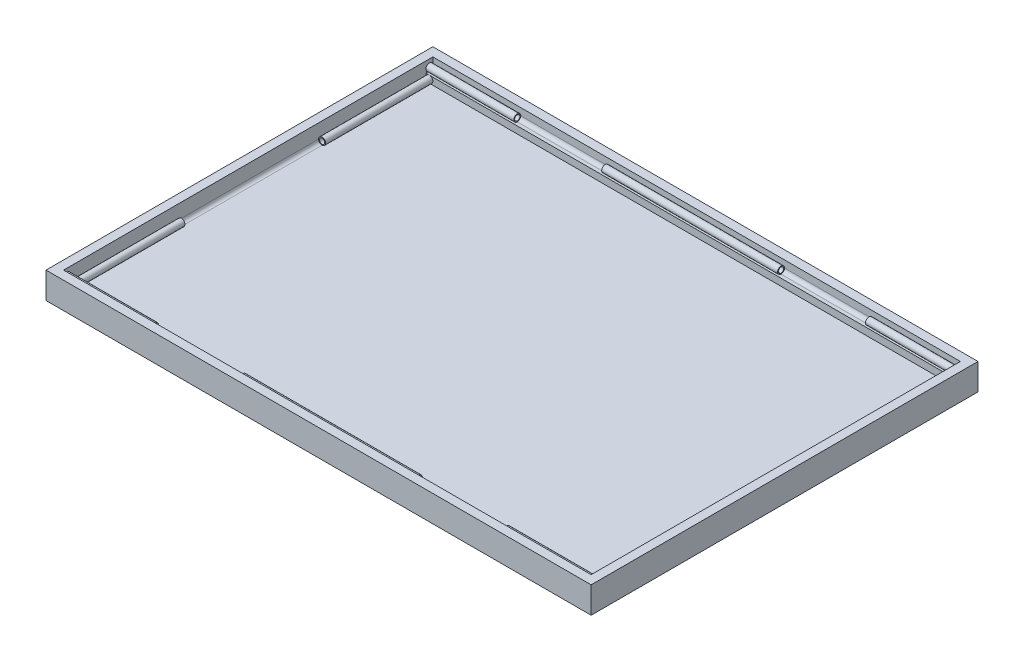
from build123d import *

# Parameters (mm, degrees)
SKETCH_1_W           = 310
SKETCH_1_H           = 220
EXTRUDE_1_DEPTH      = 15
SKETCH_2_W           = 300
SKETCH_2_H           = 210
CUT_EXTRUDE_4_DEPTH  = 6
SKETCH_6_W           = 300
SKETCH_6_H           = 2
EXTRUDE_3_DEPTH      = 2
SKETCH_8_R           = 2
CUT_EXTRUDE_5_DEPTH  = 300
SKETCH_8_2_R         = 2
SKETCH_8_2_R_2       = 1.5
EXTRUDE_1_2_DEPTH    = 300
SKETCH_10_R          = 2
CUT_EXTRUDE_6_DEPTH  = 300
SKETCH_10_2_R        = 2
SKETCH_10_2_R_2      = 1.5
EXTRUDE_2_DEPTH      = 300
SKETCH_12_R          = 2
CUT_EXTRUDE_7_DEPTH  = 50
SKETCH_13_R          = 2
CUT_EXTRUDE_8_DEPTH  = 50
SKETCH_15_W          = 300
SKETCH_15_H          = 202
CUT_EXTRUDE_9_DEPTH  = 4
SKETCH_16_W          = 2
SKETCH_16_H          = 202
EXTRUDE_4_DEPTH      = 2
SKETCH_14_R          = 2
CUT_EXTRUDE_10_DEPTH = 202
SKETCH_14_2_R        = 2
SKETCH_14_2_R_2      = 1.5
EXTRUDE_3_2_DEPTH    = 202
SKETCH_18_R          = 2
CUT_EXTRUDE_11_DEPTH = 80


with BuildPart() as part:
    # 草图1 → Extrude 1 (new body)
    with BuildSketch(Plane(origin=(0, 0, 0), x_dir=(1, 0, 0), z_dir=(0, 1, 0))):
        with Locations((0.660377358, 22.830188679)):
            Rectangle(SKETCH_1_W, SKETCH_1_H)
    extrude(amount=EXTRUDE_1_DEPTH)

    # 草图2 → 切除-拉伸4 (cut)
    with BuildSketch(Plane(origin=(0, 15, 0), x_dir=(1, 0, 0), z_dir=(0, 1, 0))):
        with Locations((0.660377358, 22.830188679)):
            Rectangle(SKETCH_2_W, SKETCH_2_H)
    extrude(amount=-CUT_EXTRUDE_4_DEPTH, mode=Mode.SUBTRACT)

    # 草图6 → Extrude 3 (add)
    with BuildSketch(Plane(origin=(0, 9, 0), x_dir=(1, 0, 0), z_dir=(0, 1, 0))):
        with Locations((0.660377358, 126.830188679)):
            Rectangle(SKETCH_6_W, SKETCH_6_H)
        with Locations((0.660377358, -81.169811321)):
            Rectangle(SKETCH_6_W, SKETCH_6_H)
    extrude(amount=EXTRUDE_3_DEPTH)

    # 草图8 → 切除-拉伸5 (cut)
    with BuildSketch(Plane(origin=(150.660377358, 0, 0), x_dir=(0, 0, -1), z_dir=(1, 0, 0))):
        with Locations((-80.169811321, 11)):
            Circle(SKETCH_8_R)
    extrude(amount=-CUT_EXTRUDE_5_DEPTH, mode=Mode.SUBTRACT)

    # 草图8<2> → Extrude 1 2 (add)
    with BuildSketch(Plane(origin=(150.660377358, 0, 0), x_dir=(0, 0, -1), z_dir=(1, 0, 0))):
        with Locations((-80.169811321, 11)):
            Circle(SKETCH_8_2_R)
        with Locations((-80.169811321, 11)):
            Circle(SKETCH_8_2_R_2, mode=Mode.SUBTRACT)
    extrude(amount=-EXTRUDE_1_2_DEPTH)

    # 草图10 → 切除-拉伸6 (cut)
    with BuildSketch(Plane(origin=(150.660377358, 0, 0), x_dir=(0, 0, -1), z_dir=(1, 0, 0))):
        with Locations((125.830188679, 11)):
            Circle(SKETCH_10_R)
    extrude(amount=-CUT_EXTRUDE_6_DEPTH, mode=Mode.SUBTRACT)

    # 草图10<2> → 拉伸-薄壁2 (add)
    with BuildSketch(Plane(origin=(150.660377358, 0, 0), x_dir=(0, 0, -1), z_dir=(1, 0, 0))):
        with Locations((125.830188679, 11)):
            Circle(SKETCH_10_2_R)
        with Locations((125.830188679, 11)):
            Circle(SKETCH_10_2_R_2, mode=Mode.SUBTRACT)
    extrude(amount=-EXTRUDE_2_DEPTH)

    # 草图12 → 切除-拉伸7 (cut)
    with BuildSketch(Plane(origin=(100.660377358, 0, 0), x_dir=(0, 0, -1), z_dir=(1, 0, 0))):
        with Locations((-80.169811321, 11)):
            Circle(SKETCH_12_R)
        with Locations((125.830188679, 11)):
            Circle(SKETCH_12_R)
    extrude(amount=-CUT_EXTRUDE_7_DEPTH, mode=Mode.SUBTRACT)

    # 草图13 → 切除-拉伸8 (cut)
    with BuildSketch(Plane(origin=(-49.339622642, 0, 0), x_dir=(0, 0, -1), z_dir=(1, 0, 0))):
        with Locations((-80.169811321, 11)):
            Circle(SKETCH_13_R)
        with Locations((125.830188679, 11)):
            Circle(SKETCH_13_R)
    extrude(amount=-CUT_EXTRUDE_8_DEPTH, mode=Mode.SUBTRACT)

    # 草图15 → 切除-拉伸9 (cut)
    with BuildSketch(Plane(origin=(0, 9, 0), x_dir=(1, 0, 0), z_dir=(0, 1, 0))):
        with Locations((0.660377358, 22.830188679)):
            Rectangle(SKETCH_15_W, SKETCH_15_H)
    extrude(amount=-CUT_EXTRUDE_9_DEPTH, mode=Mode.SUBTRACT)

    # 草图16 → 凸台-拉伸4 (add)
    with BuildSketch(Plane(origin=(0, 5, 0), x_dir=(1, 0, 0), z_dir=(0, 1, 0))):
        with Locations((-148.339622642, 22.830188679)):
            Rectangle(SKETCH_16_W, SKETCH_16_H)
        with Locations((149.660377358, 22.830188679)):
            Rectangle(SKETCH_16_W, SKETCH_16_H)
    extrude(amount=EXTRUDE_4_DEPTH)

    # 草图14 → 切除-拉伸10 (cut)
    with BuildSketch(Plane.XY.offset(78.169811321)):
        with Locations((-147.339622642, 7)):
            Circle(SKETCH_14_R)
        with Locations((148.660377358, 7)):
            Circle(SKETCH_14_R)
    extrude(amount=-CUT_EXTRUDE_10_DEPTH, mode=Mode.SUBTRACT)

    # 草图14<2> → Extrude 3 2 (add)
    # profile 1 of 2: a face of its own
    with BuildSketch(Plane.XY.offset(78.169811321)):
        with Locations((-147.339622642, 7)):
            Circle(SKETCH_14_2_R)
        with Locations((-147.339622642, 7)):
            Circle(SKETCH_14_2_R_2, mode=Mode.SUBTRACT)
    # profile 2 of 2: a face of its own
    with BuildSketch(Plane.XY.offset(78.169811321)):
        with Locations((148.660377358, 7)):
            Circle(SKETCH_14_2_R)
        with Locations((148.660377358, 7)):
            Circle(SKETCH_14_2_R_2, mode=Mode.SUBTRACT)
    extrude(amount=-EXTRUDE_3_2_DEPTH)

    # 草图18 → 切除-拉伸11 (cut)
    with BuildSketch(Plane.XY.offset(17.169811321)):
        with Locations((-147.339622642, 7)):
            Circle(SKETCH_18_R)
        with Locations((148.660377358, 7)):
            Circle(SKETCH_18_R)
    extrude(amount=-CUT_EXTRUDE_11_DEPTH, mode=Mode.SUBTRACT)


solid = part.part
